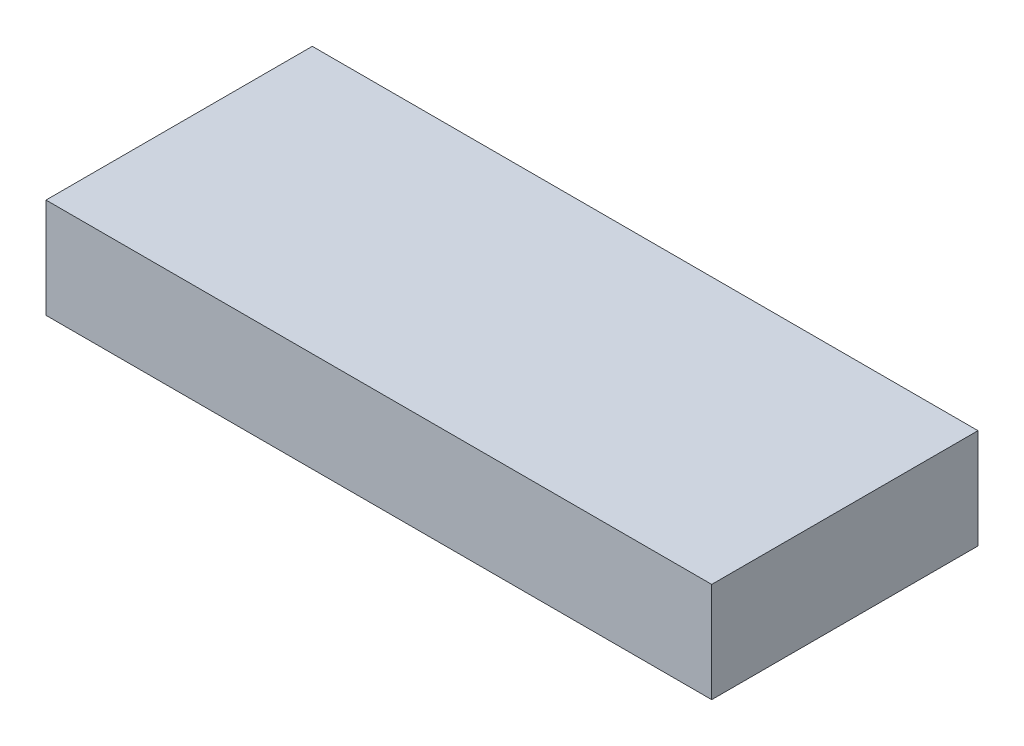
from build123d import *

# Parameters (mm, degrees)
SKETCH1_W           = 63.5
SKETCH1_H           = 25.4
BOSS_EXTRUDE1_DEPTH = 9.525


with BuildPart() as part:
    # Sketch1 → Boss-Extrude1 (new body)
    with BuildSketch(Plane(origin=(0, 0, 0), x_dir=(1, 0, 0), z_dir=(0, 1, 0))):
        Rectangle(SKETCH1_W, SKETCH1_H)
    extrude(amount=BOSS_EXTRUDE1_DEPTH)


solid = part.part
